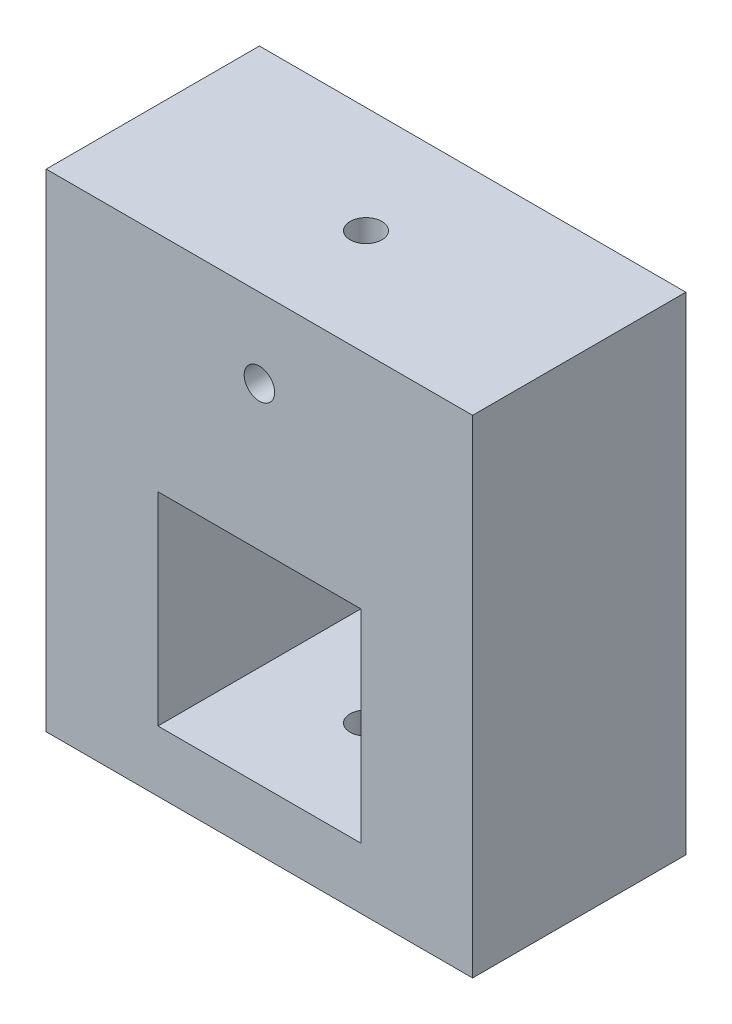
from build123d import *

# Parameters (mm, degrees)
SKETCH1_W           = 88.9
SKETCH1_H           = 44.45
SKETCH1_R           = 3.323105079
BOSS_EXTRUDE1_DEPTH = 101.6
SKETCH2_R           = 3.175
SKETCH2_W           = 42.3
SKETCH2_H           = 42.3
CUT_EXTRUDE1_DEPTH  = 120.474537036


with BuildPart() as part:
    # Sketch1 → Boss-Extrude1 (new body)
    with BuildSketch(Plane(origin=(0, 0, 0), x_dir=(1, 0, 0), z_dir=(0, 1, 0))):
        Rectangle(SKETCH1_W, SKETCH1_H)
        with Locations(Location((0, 0, 0), (0, 0, 270))):
            Circle(SKETCH1_R, mode=Mode.SUBTRACT)
    extrude(amount=BOSS_EXTRUDE1_DEPTH)

    # Sketch2 → Cut-Extrude1 (cut, through all)
    with BuildSketch(Plane.XY.offset(22.225)):
        with Locations((0, 85.09)):
            Circle(SKETCH2_R)
        with Locations((0, 33.85)):
            Rectangle(SKETCH2_W, SKETCH2_H)
    extrude(amount=-CUT_EXTRUDE1_DEPTH, mode=Mode.SUBTRACT)


solid = part.part
